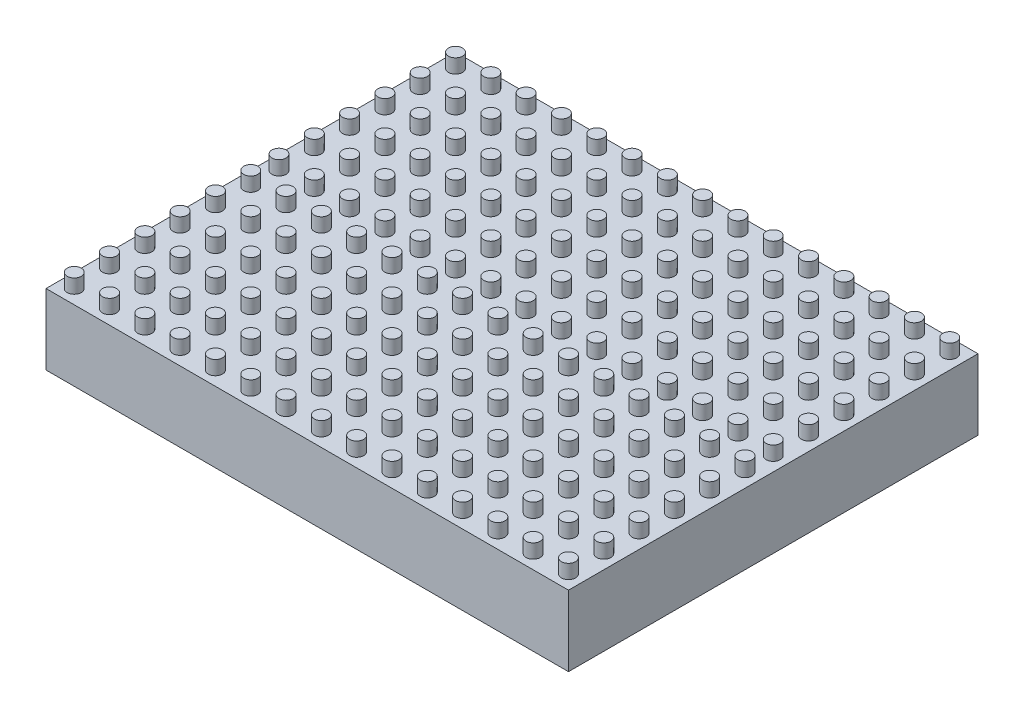
from build123d import *

# Parameters (mm, degrees)
SKETCH_1_W      = 740
SKETCH_1_H      = 580
EXTRUDE_1_DEPTH = 100
SKETCH_2_R      = 10
EXTRUDE_3_DEPTH = 20


with BuildPart() as part:
    # 草图1 → 凸台-拉伸1 (new body)
    with BuildSketch(Plane(origin=(0, 0, 0), x_dir=(1, 0, 0), z_dir=(0, 1, 0))):
        Rectangle(SKETCH_1_W, SKETCH_1_H)
    extrude(amount=EXTRUDE_1_DEPTH)

    # 草图2 → 凸台-拉伸3 (add)
    with BuildSketch(Plane(origin=(0, 100, 0), x_dir=(1, 0, 0), z_dir=(0, 1, 0))):
        with Locations(Location((-350, 270, 0), (0, 0, 270))):
            Circle(SKETCH_2_R)
        with Locations(Location((-300, 270, 0), (0, 0, 270))):
            Circle(SKETCH_2_R)
        with Locations(Location((-250, 270, 0), (0, 0, 270))):
            Circle(SKETCH_2_R)
        with Locations(Location((-200, 270, 0), (0, 0, 270))):
            Circle(SKETCH_2_R)
        with Locations(Location((-150, 270, 0), (0, 0, 270))):
            Circle(SKETCH_2_R)
        with Locations(Location((-100, 270, 0), (0, 0, 270))):
            Circle(SKETCH_2_R)
        with Locations(Location((-50, 270, 0), (0, 0, 270))):
            Circle(SKETCH_2_R)
        with Locations(Location((0, 270, 0), (0, 0, 270))):
            Circle(SKETCH_2_R)
        with Locations(Location((50, 270, 0), (0, 0, 270))):
            Circle(SKETCH_2_R)
        with Locations(Location((100, 270, 0), (0, 0, 270))):
            Circle(SKETCH_2_R)
        with Locations(Location((150, 270, 0), (0, 0, 270))):
            Circle(SKETCH_2_R)
        with Locations(Location((200, 270, 0), (0, 0, 270))):
            Circle(SKETCH_2_R)
        with Locations(Location((250, 270, 0), (0, 0, 270))):
            Circle(SKETCH_2_R)
        with Locations(Location((300, 270, 0), (0, 0, 270))):
            Circle(SKETCH_2_R)
        with Locations(Location((350, 270, 0), (0, 0, 270))):
            Circle(SKETCH_2_R)
        with Locations(Location((-300, 220, 0), (0, 0, 270))):
            Circle(SKETCH_2_R)
        with Locations(Location((-250, 220, 0), (0, 0, 270))):
            Circle(SKETCH_2_R)
        with Locations(Location((-200, 220, 0), (0, 0, 270))):
            Circle(SKETCH_2_R)
        with Locations(Location((-150, 220, 0), (0, 0, 270))):
            Circle(SKETCH_2_R)
        with Locations(Location((-100, 220, 0), (0, 0, 270))):
            Circle(SKETCH_2_R)
        with Locations(Location((-50, 220, 0), (0, 0, 270))):
            Circle(SKETCH_2_R)
        with Locations(Location((0, 220, 0), (0, 0, 270))):
            Circle(SKETCH_2_R)
        with Locations(Location((50, 220, 0), (0, 0, 270))):
            Circle(SKETCH_2_R)
        with Locations(Location((100, 220, 0), (0, 0, 270))):
            Circle(SKETCH_2_R)
        with Locations(Location((150, 220, 0), (0, 0, 270))):
            Circle(SKETCH_2_R)
        with Locations(Location((200, 220, 0), (0, 0, 270))):
            Circle(SKETCH_2_R)
        with Locations(Location((250, 220, 0), (0, 0, 270))):
            Circle(SKETCH_2_R)
        with Locations(Location((300, 220, 0), (0, 0, 270))):
            Circle(SKETCH_2_R)
        with Locations(Location((350, 220, 0), (0, 0, 270))):
            Circle(SKETCH_2_R)
        with Locations(Location((-300, 170, 0), (0, 0, 270))):
            Circle(SKETCH_2_R)
        with Locations(Location((-250, 170, 0), (0, 0, 270))):
            Circle(SKETCH_2_R)
        with Locations(Location((-200, 170, 0), (0, 0, 270))):
            Circle(SKETCH_2_R)
        with Locations(Location((-150, 170, 0), (0, 0, 270))):
            Circle(SKETCH_2_R)
        with Locations(Location((-100, 170, 0), (0, 0, 270))):
            Circle(SKETCH_2_R)
        with Locations(Location((-50, 170, 0), (0, 0, 270))):
            Circle(SKETCH_2_R)
        with Locations(Location((0, 170, 0), (0, 0, 270))):
            Circle(SKETCH_2_R)
        with Locations(Location((50, 170, 0), (0, 0, 270))):
            Circle(SKETCH_2_R)
        with Locations(Location((100, 170, 0), (0, 0, 270))):
            Circle(SKETCH_2_R)
        with Locations(Location((150, 170, 0), (0, 0, 270))):
            Circle(SKETCH_2_R)
        with Locations(Location((200, 170, 0), (0, 0, 270))):
            Circle(SKETCH_2_R)
        with Locations(Location((250, 170, 0), (0, 0, 270))):
            Circle(SKETCH_2_R)
        with Locations(Location((300, 170, 0), (0, 0, 270))):
            Circle(SKETCH_2_R)
        with Locations(Location((350, 170, 0), (0, 0, 270))):
            Circle(SKETCH_2_R)
        with Locations(Location((-300, 120, 0), (0, 0, 270))):
            Circle(SKETCH_2_R)
        with Locations(Location((-250, 120, 0), (0, 0, 270))):
            Circle(SKETCH_2_R)
        with Locations(Location((-200, 120, 0), (0, 0, 270))):
            Circle(SKETCH_2_R)
        with Locations(Location((-150, 120, 0), (0, 0, 270))):
            Circle(SKETCH_2_R)
        with Locations(Location((-100, 120, 0), (0, 0, 270))):
            Circle(SKETCH_2_R)
        with Locations(Location((-50, 120, 0), (0, 0, 270))):
            Circle(SKETCH_2_R)
        with Locations(Location((0, 120, 0), (0, 0, 270))):
            Circle(SKETCH_2_R)
        with Locations(Location((50, 120, 0), (0, 0, 270))):
            Circle(SKETCH_2_R)
        with Locations(Location((100, 120, 0), (0, 0, 270))):
            Circle(SKETCH_2_R)
        with Locations(Location((150, 120, 0), (0, 0, 270))):
            Circle(SKETCH_2_R)
        with Locations(Location((200, 120, 0), (0, 0, 270))):
            Circle(SKETCH_2_R)
        with Locations(Location((250, 120, 0), (0, 0, 270))):
            Circle(SKETCH_2_R)
        with Locations(Location((300, 120, 0), (0, 0, 270))):
            Circle(SKETCH_2_R)
        with Locations(Location((350, 120, 0), (0, 0, 270))):
            Circle(SKETCH_2_R)
        with Locations(Location((-300, 70, 0), (0, 0, 270))):
            Circle(SKETCH_2_R)
        with Locations(Location((-250, 70, 0), (0, 0, 270))):
            Circle(SKETCH_2_R)
        with Locations(Location((-200, 70, 0), (0, 0, 270))):
            Circle(SKETCH_2_R)
        with Locations(Location((-150, 70, 0), (0, 0, 270))):
            Circle(SKETCH_2_R)
        with Locations(Location((-100, 70, 0), (0, 0, 270))):
            Circle(SKETCH_2_R)
        with Locations(Location((-50, 70, 0), (0, 0, 270))):
            Circle(SKETCH_2_R)
        with Locations(Location((0, 70, 0), (0, 0, 270))):
            Circle(SKETCH_2_R)
        with Locations(Location((50, 70, 0), (0, 0, 270))):
            Circle(SKETCH_2_R)
        with Locations(Location((100, 70, 0), (0, 0, 270))):
            Circle(SKETCH_2_R)
        with Locations(Location((150, 70, 0), (0, 0, 270))):
            Circle(SKETCH_2_R)
        with Locations(Location((200, 70, 0), (0, 0, 270))):
            Circle(SKETCH_2_R)
        with Locations(Location((250, 70, 0), (0, 0, 270))):
            Circle(SKETCH_2_R)
        with Locations(Location((300, 70, 0), (0, 0, 270))):
            Circle(SKETCH_2_R)
        with Locations(Location((350, 70, 0), (0, 0, 270))):
            Circle(SKETCH_2_R)
        with Locations(Location((-300, 20, 0), (0, 0, 270))):
            Circle(SKETCH_2_R)
        with Locations(Location((-250, 20, 0), (0, 0, 270))):
            Circle(SKETCH_2_R)
        with Locations(Location((-200, 20, 0), (0, 0, 270))):
            Circle(SKETCH_2_R)
        with Locations(Location((-150, 20, 0), (0, 0, 270))):
            Circle(SKETCH_2_R)
        with Locations(Location((-100, 20, 0), (0, 0, 270))):
            Circle(SKETCH_2_R)
        with Locations(Location((-50, 20, 0), (0, 0, 270))):
            Circle(SKETCH_2_R)
        with Locations(Location((0, 20, 0), (0, 0, 270))):
            Circle(SKETCH_2_R)
        with Locations(Location((50, 20, 0), (0, 0, 270))):
            Circle(SKETCH_2_R)
        with Locations(Location((100, 20, 0), (0, 0, 270))):
            Circle(SKETCH_2_R)
        with Locations(Location((150, 20, 0), (0, 0, 270))):
            Circle(SKETCH_2_R)
        with Locations(Location((200, 20, 0), (0, 0, 270))):
            Circle(SKETCH_2_R)
        with Locations(Location((250, 20, 0), (0, 0, 270))):
            Circle(SKETCH_2_R)
        with Locations(Location((300, 20, 0), (0, 0, 270))):
            Circle(SKETCH_2_R)
        with Locations(Location((350, 20, 0), (0, 0, 270))):
            Circle(SKETCH_2_R)
        with Locations(Location((-350, 220, 0), (0, 0, 270))):
            Circle(SKETCH_2_R)
        with Locations(Location((-350, 170, 0), (0, 0, 270))):
            Circle(SKETCH_2_R)
        with Locations(Location((-350, 120, 0), (0, 0, 270))):
            Circle(SKETCH_2_R)
        with Locations(Location((-350, 70, 0), (0, 0, 270))):
            Circle(SKETCH_2_R)
        with Locations(Location((-350, 20, 0), (0, 0, 270))):
            Circle(SKETCH_2_R)
        with Locations(Location((350, -270, 0), (0, 0, 270))):
            Circle(SKETCH_2_R)
        with Locations(Location((300, -270, 0), (0, 0, 270))):
            Circle(SKETCH_2_R)
        with Locations(Location((250, -270, 0), (0, 0, 270))):
            Circle(SKETCH_2_R)
        with Locations(Location((200, -270, 0), (0, 0, 270))):
            Circle(SKETCH_2_R)
        with Locations(Location((150, -270, 0), (0, 0, 270))):
            Circle(SKETCH_2_R)
        with Locations(Location((100, -270, 0), (0, 0, 270))):
            Circle(SKETCH_2_R)
        with Locations(Location((50, -270, 0), (0, 0, 270))):
            Circle(SKETCH_2_R)
        with Locations(Location((0, -270, 0), (0, 0, 270))):
            Circle(SKETCH_2_R)
        with Locations(Location((-50, -270, 0), (0, 0, 270))):
            Circle(SKETCH_2_R)
        with Locations(Location((-100, -270, 0), (0, 0, 270))):
            Circle(SKETCH_2_R)
        with Locations(Location((-150, -270, 0), (0, 0, 270))):
            Circle(SKETCH_2_R)
        with Locations(Location((-200, -270, 0), (0, 0, 270))):
            Circle(SKETCH_2_R)
        with Locations(Location((-250, -270, 0), (0, 0, 270))):
            Circle(SKETCH_2_R)
        with Locations(Location((-300, -270, 0), (0, 0, 270))):
            Circle(SKETCH_2_R)
        with Locations(Location((-350, -270, 0), (0, 0, 270))):
            Circle(SKETCH_2_R)
        with Locations(Location((300, -220, 0), (0, 0, 270))):
            Circle(SKETCH_2_R)
        with Locations(Location((250, -220, 0), (0, 0, 270))):
            Circle(SKETCH_2_R)
        with Locations(Location((200, -220, 0), (0, 0, 270))):
            Circle(SKETCH_2_R)
        with Locations(Location((150, -220, 0), (0, 0, 270))):
            Circle(SKETCH_2_R)
        with Locations(Location((100, -220, 0), (0, 0, 270))):
            Circle(SKETCH_2_R)
        with Locations(Location((50, -220, 0), (0, 0, 270))):
            Circle(SKETCH_2_R)
        with Locations(Location((0, -220, 0), (0, 0, 270))):
            Circle(SKETCH_2_R)
        with Locations(Location((-50, -220, 0), (0, 0, 270))):
            Circle(SKETCH_2_R)
        with Locations(Location((-100, -220, 0), (0, 0, 270))):
            Circle(SKETCH_2_R)
        with Locations(Location((-150, -220, 0), (0, 0, 270))):
            Circle(SKETCH_2_R)
        with Locations(Location((-200, -220, 0), (0, 0, 270))):
            Circle(SKETCH_2_R)
        with Locations(Location((-250, -220, 0), (0, 0, 270))):
            Circle(SKETCH_2_R)
        with Locations(Location((-300, -220, 0), (0, 0, 270))):
            Circle(SKETCH_2_R)
        with Locations(Location((-350, -220, 0), (0, 0, 270))):
            Circle(SKETCH_2_R)
        with Locations(Location((300, -170, 0), (0, 0, 270))):
            Circle(SKETCH_2_R)
        with Locations(Location((250, -170, 0), (0, 0, 270))):
            Circle(SKETCH_2_R)
        with Locations(Location((200, -170, 0), (0, 0, 270))):
            Circle(SKETCH_2_R)
        with Locations(Location((150, -170, 0), (0, 0, 270))):
            Circle(SKETCH_2_R)
        with Locations(Location((100, -170, 0), (0, 0, 270))):
            Circle(SKETCH_2_R)
        with Locations(Location((50, -170, 0), (0, 0, 270))):
            Circle(SKETCH_2_R)
        with Locations(Location((0, -170, 0), (0, 0, 270))):
            Circle(SKETCH_2_R)
        with Locations(Location((-50, -170, 0), (0, 0, 270))):
            Circle(SKETCH_2_R)
        with Locations(Location((-100, -170, 0), (0, 0, 270))):
            Circle(SKETCH_2_R)
        with Locations(Location((-150, -170, 0), (0, 0, 270))):
            Circle(SKETCH_2_R)
        with Locations(Location((-200, -170, 0), (0, 0, 270))):
            Circle(SKETCH_2_R)
        with Locations(Location((-250, -170, 0), (0, 0, 270))):
            Circle(SKETCH_2_R)
        with Locations(Location((-300, -170, 0), (0, 0, 270))):
            Circle(SKETCH_2_R)
        with Locations(Location((-350, -170, 0), (0, 0, 270))):
            Circle(SKETCH_2_R)
        with Locations(Location((300, -120, 0), (0, 0, 270))):
            Circle(SKETCH_2_R)
        with Locations(Location((250, -120, 0), (0, 0, 270))):
            Circle(SKETCH_2_R)
        with Locations(Location((200, -120, 0), (0, 0, 270))):
            Circle(SKETCH_2_R)
        with Locations(Location((150, -120, 0), (0, 0, 270))):
            Circle(SKETCH_2_R)
        with Locations(Location((100, -120, 0), (0, 0, 270))):
            Circle(SKETCH_2_R)
        with Locations(Location((50, -120, 0), (0, 0, 270))):
            Circle(SKETCH_2_R)
        with Locations(Location((0, -120, 0), (0, 0, 270))):
            Circle(SKETCH_2_R)
        with Locations(Location((-50, -120, 0), (0, 0, 270))):
            Circle(SKETCH_2_R)
        with Locations(Location((-100, -120, 0), (0, 0, 270))):
            Circle(SKETCH_2_R)
        with Locations(Location((-150, -120, 0), (0, 0, 270))):
            Circle(SKETCH_2_R)
        with Locations(Location((-200, -120, 0), (0, 0, 270))):
            Circle(SKETCH_2_R)
        with Locations(Location((-250, -120, 0), (0, 0, 270))):
            Circle(SKETCH_2_R)
        with Locations(Location((-300, -120, 0), (0, 0, 270))):
            Circle(SKETCH_2_R)
        with Locations(Location((-350, -120, 0), (0, 0, 270))):
            Circle(SKETCH_2_R)
        with Locations(Location((300, -70, 0), (0, 0, 270))):
            Circle(SKETCH_2_R)
        with Locations(Location((250, -70, 0), (0, 0, 270))):
            Circle(SKETCH_2_R)
        with Locations(Location((200, -70, 0), (0, 0, 270))):
            Circle(SKETCH_2_R)
        with Locations(Location((150, -70, 0), (0, 0, 270))):
            Circle(SKETCH_2_R)
        with Locations(Location((100, -70, 0), (0, 0, 270))):
            Circle(SKETCH_2_R)
        with Locations(Location((50, -70, 0), (0, 0, 270))):
            Circle(SKETCH_2_R)
        with Locations(Location((0, -70, 0), (0, 0, 270))):
            Circle(SKETCH_2_R)
        with Locations(Location((-50, -70, 0), (0, 0, 270))):
            Circle(SKETCH_2_R)
        with Locations(Location((-100, -70, 0), (0, 0, 270))):
            Circle(SKETCH_2_R)
        with Locations(Location((-150, -70, 0), (0, 0, 270))):
            Circle(SKETCH_2_R)
        with Locations(Location((-200, -70, 0), (0, 0, 270))):
            Circle(SKETCH_2_R)
        with Locations(Location((-250, -70, 0), (0, 0, 270))):
            Circle(SKETCH_2_R)
        with Locations(Location((-300, -70, 0), (0, 0, 270))):
            Circle(SKETCH_2_R)
        with Locations(Location((-350, -70, 0), (0, 0, 270))):
            Circle(SKETCH_2_R)
        with Locations(Location((300, -20, 0), (0, 0, 270))):
            Circle(SKETCH_2_R)
        with Locations(Location((250, -20, 0), (0, 0, 270))):
            Circle(SKETCH_2_R)
        with Locations(Location((200, -20, 0), (0, 0, 270))):
            Circle(SKETCH_2_R)
        with Locations(Location((150, -20, 0), (0, 0, 270))):
            Circle(SKETCH_2_R)
        with Locations(Location((100, -20, 0), (0, 0, 270))):
            Circle(SKETCH_2_R)
        with Locations(Location((50, -20, 0), (0, 0, 270))):
            Circle(SKETCH_2_R)
        with Locations(Location((0, -20, 0), (0, 0, 270))):
            Circle(SKETCH_2_R)
        with Locations(Location((-50, -20, 0), (0, 0, 270))):
            Circle(SKETCH_2_R)
        with Locations(Location((-100, -20, 0), (0, 0, 270))):
            Circle(SKETCH_2_R)
        with Locations(Location((-150, -20, 0), (0, 0, 270))):
            Circle(SKETCH_2_R)
        with Locations(Location((-200, -20, 0), (0, 0, 270))):
            Circle(SKETCH_2_R)
        with Locations(Location((-250, -20, 0), (0, 0, 270))):
            Circle(SKETCH_2_R)
        with Locations(Location((-300, -20, 0), (0, 0, 270))):
            Circle(SKETCH_2_R)
        with Locations(Location((-350, -20, 0), (0, 0, 270))):
            Circle(SKETCH_2_R)
        with Locations(Location((350, -220, 0), (0, 0, 270))):
            Circle(SKETCH_2_R)
        with Locations(Location((350, -170, 0), (0, 0, 270))):
            Circle(SKETCH_2_R)
        with Locations(Location((350, -120, 0), (0, 0, 270))):
            Circle(SKETCH_2_R)
        with Locations(Location((350, -70, 0), (0, 0, 270))):
            Circle(SKETCH_2_R)
        with Locations(Location((350, -20, 0), (0, 0, 270))):
            Circle(SKETCH_2_R)
    extrude(amount=EXTRUDE_3_DEPTH)

    # 草图3 → section 0 of loft_1
    with BuildSketch(Plane(origin=(0, -200, 0), x_dir=(-1, 0, 0), z_dir=(0, -1, 0)), mode=Mode.PRIVATE) as loft_1_s0:
        with BuildLine():
            Line((-90, 50), (90, 50))
            Line((90, 50), (90, -50))
            Line((90, -50), (-90, -50))
            Line((-90, -50), (-90, 50))
        make_face()
    # loft up to a face of the part (loft_1)
    loft([loft_1_s0.sketch, part.faces().sort_by_distance((0, 0, 0))[0]])


solid = part.part
